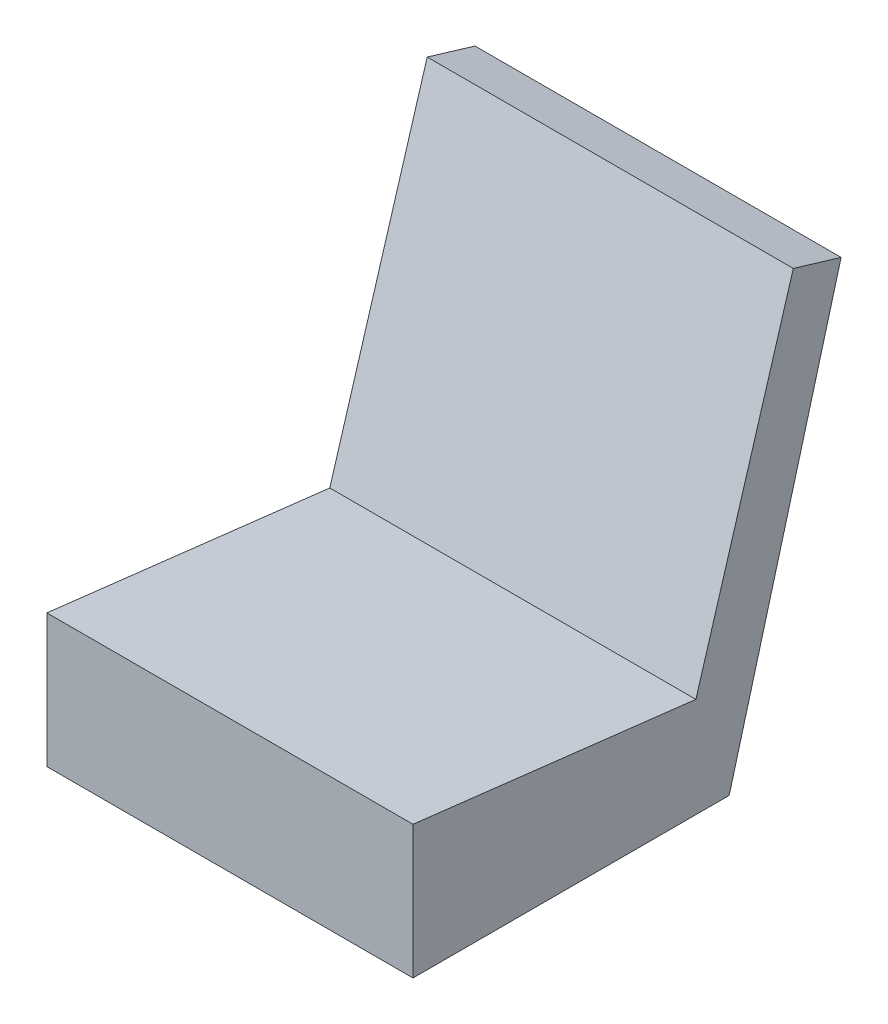
from build123d import *

# Parameters (mm, degrees)
BOSS_EXTRUDE1_DEPTH = 558.8


with BuildPart() as part:
    # Sketch1 → Boss-Extrude1 (new body)
    with BuildSketch(Plane(origin=(0, 0, 0), x_dir=(0, 0, -1), z_dir=(1, 0, 0))):
        Polygon((0, 0), (-482.6, 0), (-482.6, 203.2), (-50.8, 152.4), (97.889815453, 647.7), (170.872129127, 625.790598119), align=None)
    extrude(amount=BOSS_EXTRUDE1_DEPTH)


solid = part.part
